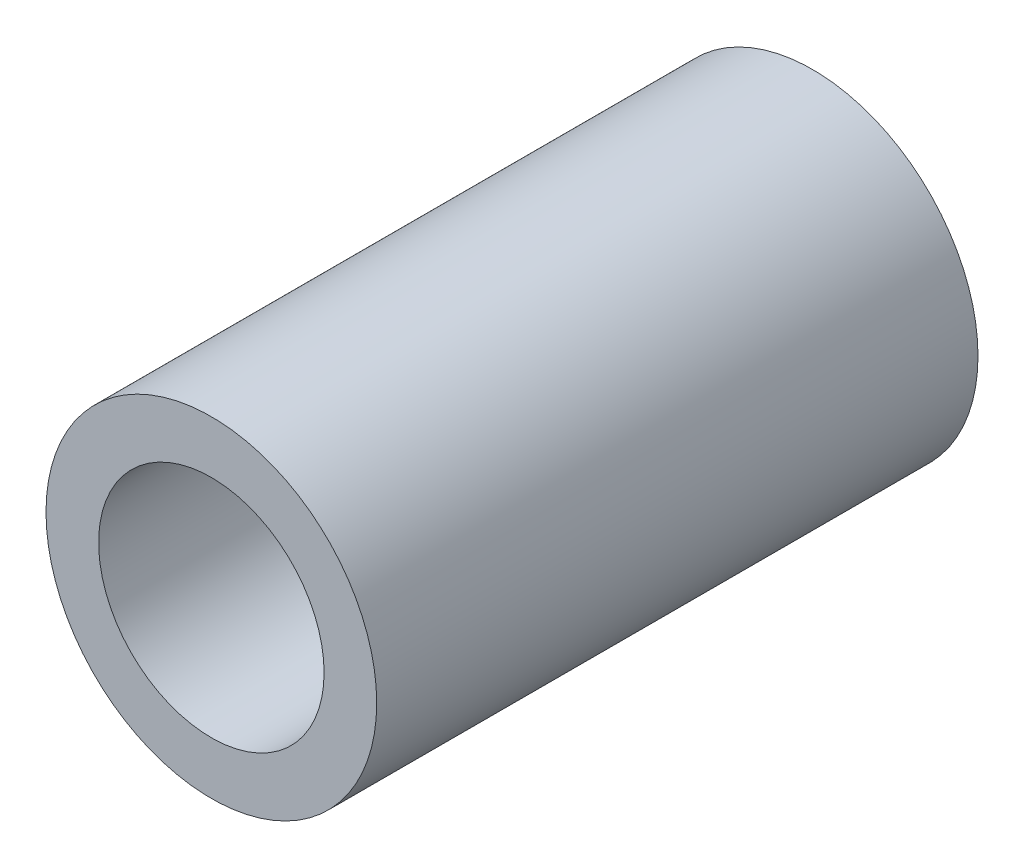
from build123d import *

# Parameters (mm, degrees)
ESQUISSE1_R        = 2.2
ESQUISSE1_R_2      = 1.5
BOSS_EXTRU_1_DEPTH = 8


with BuildPart() as part:
    # Esquisse1 → Boss.-Extru.1 (new body)
    with BuildSketch(Plane.XY):
        Circle(ESQUISSE1_R)
        Circle(ESQUISSE1_R_2, mode=Mode.SUBTRACT)
    extrude(amount=BOSS_EXTRU_1_DEPTH)


solid = part.part
